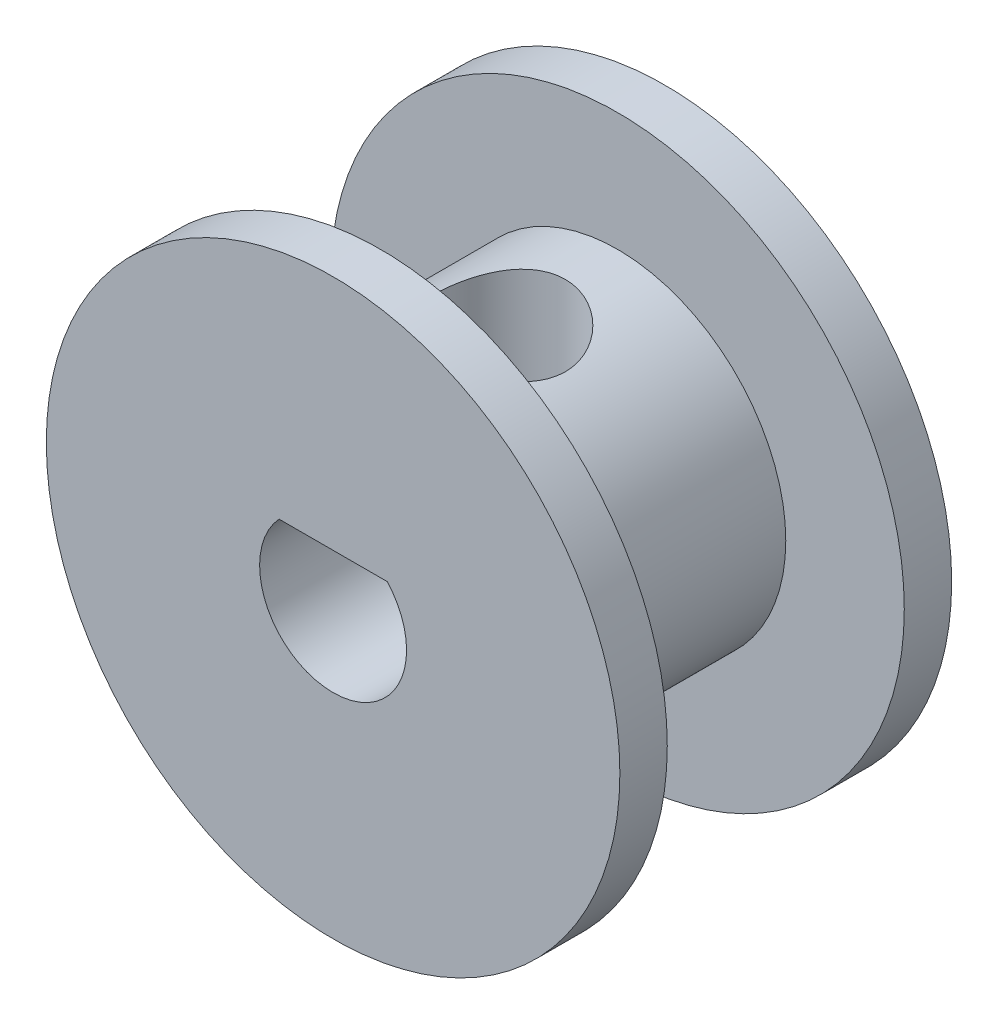
from build123d import *

# Parameters (mm, degrees)
BOSS_EXTRUDE1_DEPTH     = 7
CUT_EXTRUDE1_DEPTH      = 12.66243971
CUT_EXTRUDE1_DEPTH_BACK = 12.66243971
SKETCH5_R               = 1.4


with BuildPart() as part:
    # Sketch2 → Revolve1 (revolve)
    with BuildSketch(Plane(origin=(0, 0, 0), x_dir=(0, 0, -1), z_dir=(1, 0, 0)), mode=Mode.PRIVATE) as revolve1_sk:
        Polygon((0, 1.55), (0, 6.05), (1, 6.05), (1, 3.55), (6, 3.55), (6, 6.05), (7, 6.05), (7, 1.55), align=None)
    revolve(revolve1_sk.sketch.rotate(Axis((0, 0, 2.14137931), (0, 0, -1)), 90), axis=Axis((0, 0, 2.14137931), (0, 0, -1)))

    # Sketch4 → Boss-Extrude1 (add)
    with BuildSketch(Plane.XY):
        with BuildLine():
            ThreePointArc((1.140175425, 1.05), (0, 1.55), (-1.140175425, 1.05))
            Line((-1.140175425, 1.05), (1.140175425, 1.05))
        make_face()
    extrude(amount=-BOSS_EXTRUDE1_DEPTH)

    # Sketch5 → Cut-Extrude1 (cut, two sides: drawn at the far end of the back side and taken through both)
    with BuildSketch(Plane.XZ.offset(-1.05).offset(-CUT_EXTRUDE1_DEPTH_BACK)):
        with Locations(Location((0, -3.5, 0), (0, 0, 270))):
            Circle(SKETCH5_R)
    extrude(amount=CUT_EXTRUDE1_DEPTH + CUT_EXTRUDE1_DEPTH_BACK, mode=Mode.SUBTRACT)


solid = part.part
